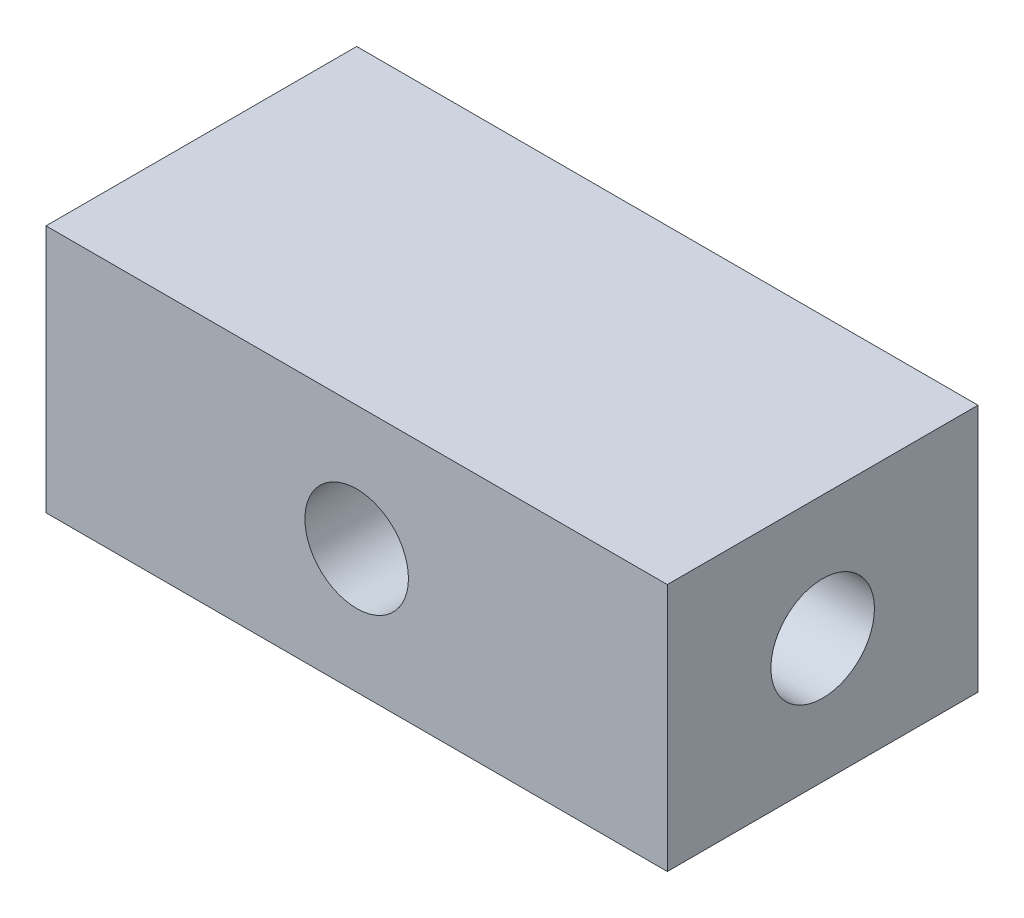
from build123d import *

# Parameters (mm, degrees)
SCHIZZO1_W                   = 30
SCHIZZO1_H                   = 12
SCHIZZO1_R                   = 2.5
ESTRUSIONE_ESTRUSIONE1_DEPTH = 7.5
TAGLIO_ESTRUSIONE1_REACH     = 33.5
SCHIZZO3_R                   = 2.5


with BuildPart() as part:
    # Schizzo1 → Estrusione-Estrusione1 (new, symmetric)
    with BuildSketch(Plane.XY):
        Rectangle(SCHIZZO1_W, SCHIZZO1_H)
        Circle(SCHIZZO1_R, mode=Mode.SUBTRACT)
    extrude(amount=ESTRUSIONE_ESTRUSIONE1_DEPTH, both=True)

    # Taglio-Estrusione1: up to this face of the body (flat: up to its plane)
    taglio_estrusione1_end = Plane(part.part.faces().sort_by_distance((-15, 0, 0))[0])
    # Schizzo3 → Taglio-Estrusione1 (cut, up to the picked face)
    with BuildSketch(Plane(origin=(15, 0, 0), x_dir=(0, 0, -1), z_dir=(1, 0, 0)), mode=Mode.PRIVATE) as taglio_estrusione1_sk1:
        Circle(SCHIZZO3_R)
    taglio_estrusione1_tool1 = split(extrude(taglio_estrusione1_sk1.sketch, amount=-TAGLIO_ESTRUSIONE1_REACH, mode=Mode.PRIVATE), bisect_by=taglio_estrusione1_end, keep=Keep.BOTH, mode=Mode.PRIVATE)
    add(taglio_estrusione1_tool1.solids().sort_by(Axis((15, 0, 0), (-1, 0, 0)))[0], mode=Mode.SUBTRACT)


solid = part.part
